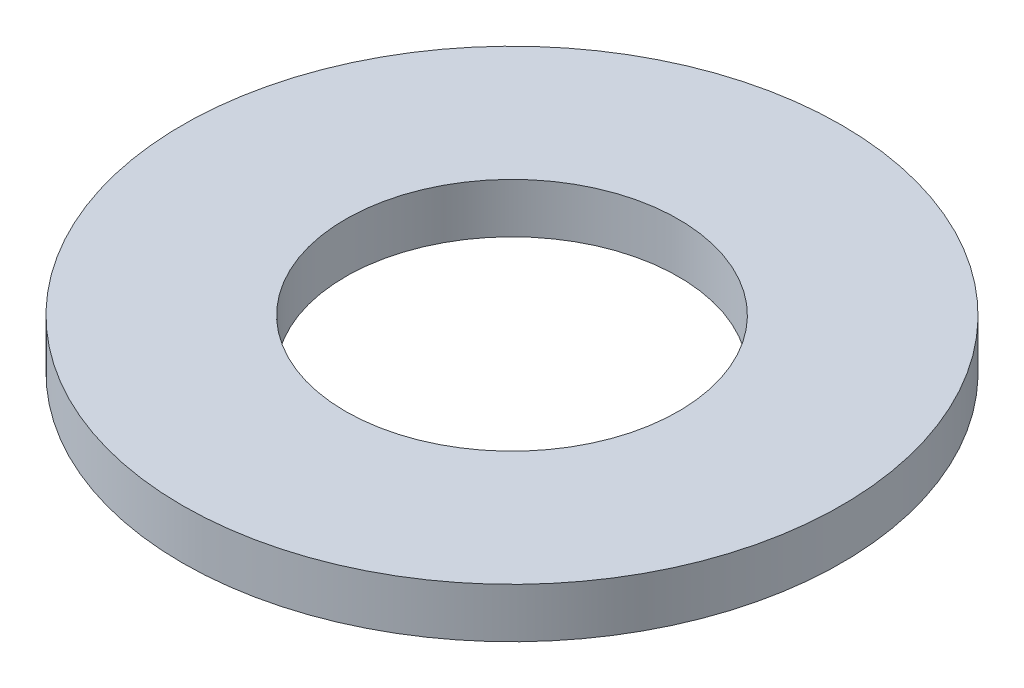
from build123d import *

# Parameters (mm, degrees)
SKETCH1_R            = 3.3655
BOSS_EXTRUDE1_DEPTH  = 0.508
M3_CLEARANCE_HOLE1_D = 3.4


with BuildPart() as part:
    # Sketch1 → Boss-Extrude1 (new body)
    with BuildSketch(Plane(origin=(0, 0, 0), x_dir=(1, 0, 0), z_dir=(0, 1, 0))):
        with Locations(Location((0, 0, 0), (0, 0, 270))):
            Circle(SKETCH1_R)
    extrude(amount=BOSS_EXTRUDE1_DEPTH)

    # M3 Clearance Hole1 (through all)
    with Locations(Plane(origin=(0, 0.508, 0), x_dir=(1, 0, 0), z_dir=(0, 1, 0))):
        with Locations((0, 0)):
            Hole(M3_CLEARANCE_HOLE1_D / 2)


solid = part.part
